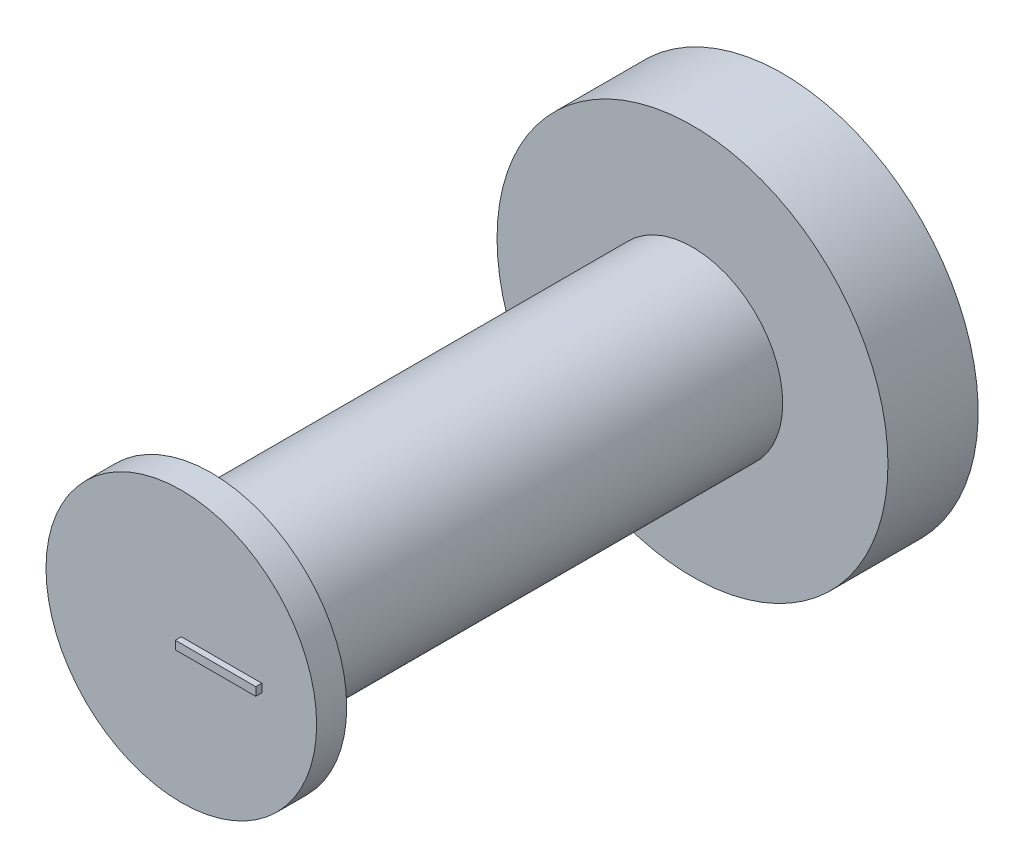
from build123d import *

# Parameters (mm, degrees)
SKETCH_1_R          = 80
EXTRUDE_1_DEPTH     = 30
SKETCH_2_R          = 30
EXTRUDE_2_DEPTH     = 160
SKETCH_3_R          = 45
EXTRUDE_3_DEPTH     = 10
SKETCH_5_W          = 26.757416482
SKETCH_5_H          = 2.773634635
EXTRUDE_6_DEPTH     = 2
SKETCH_6_R          = 97.779490514
SKETCH_6_R_2        = 65
CUT_EXTRUDE_1_DEPTH = 42
SCALE_2_SCALE       = 0.345


with BuildPart() as part:
    # 草图1 → 凸台-拉伸1 (new body)
    with BuildSketch(Plane.XY):
        Circle(SKETCH_1_R)
    extrude(amount=EXTRUDE_1_DEPTH)

    # 草图2 → 凸台-拉伸2 (add)
    with BuildSketch(Plane.XY.offset(30)):
        Circle(SKETCH_2_R)
    extrude(amount=EXTRUDE_2_DEPTH)

    # 草图3 → 凸台-拉伸3 (add)
    with BuildSketch(Plane.XY.offset(190)):
        Circle(SKETCH_3_R)
    extrude(amount=EXTRUDE_3_DEPTH)

    # 草图5 → 凸台-拉伸6 (add)
    with BuildSketch(Plane.XY.offset(200)):
        with Locations((13.378708241, 1.386817318)):
            Rectangle(SKETCH_5_W, SKETCH_5_H)
    extrude(amount=EXTRUDE_6_DEPTH)

    # 草图6 → 切除-拉伸1 (cut)
    with BuildSketch(Plane(origin=(0, 0, 0), x_dir=(-1, 0, 0), z_dir=(0, 0, -1))):
        Circle(SKETCH_6_R)
        Circle(SKETCH_6_R_2, mode=Mode.SUBTRACT)
    extrude(amount=-CUT_EXTRUDE_1_DEPTH, mode=Mode.SUBTRACT)


with BuildPart() as part_1:
    # 缩放比例2: scaled about (0, 0, 0)
    add(part.part.scale(SCALE_2_SCALE))


solid = part_1.part
